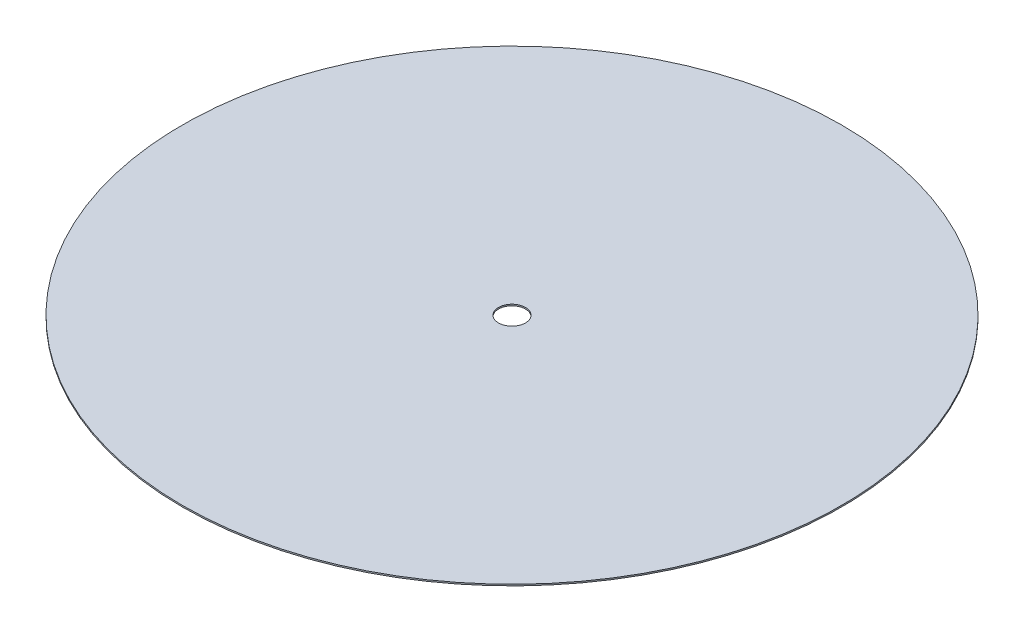
from build123d import *

# Parameters (mm, degrees)
SKETCH1_R           = 160.3375
BOSS_EXTRUDE1_DEPTH = 0.7
SKETCH2_R           = 6.55
CUT_EXTRUDE1_DEPTH  = 227.752547533


with BuildPart() as part:
    # Sketch1 → Boss-Extrude1 (new body)
    with BuildSketch(Plane(origin=(0, 0, 0), x_dir=(1, 0, 0), z_dir=(0, 1, 0))):
        with Locations(Location((0, 0, 0), (0, 0, 270))):
            Circle(SKETCH1_R)
    extrude(amount=BOSS_EXTRUDE1_DEPTH)

    # Sketch2 → Cut-Extrude1 (cut, through all)
    with BuildSketch(Plane(origin=(0, 0.7, 0), x_dir=(1, 0, 0), z_dir=(0, 1, 0))):
        with Locations(Location((0, 0, 0), (0, 0, 270))):
            Circle(SKETCH2_R)
    extrude(amount=-CUT_EXTRUDE1_DEPTH, mode=Mode.SUBTRACT)


solid = part.part
